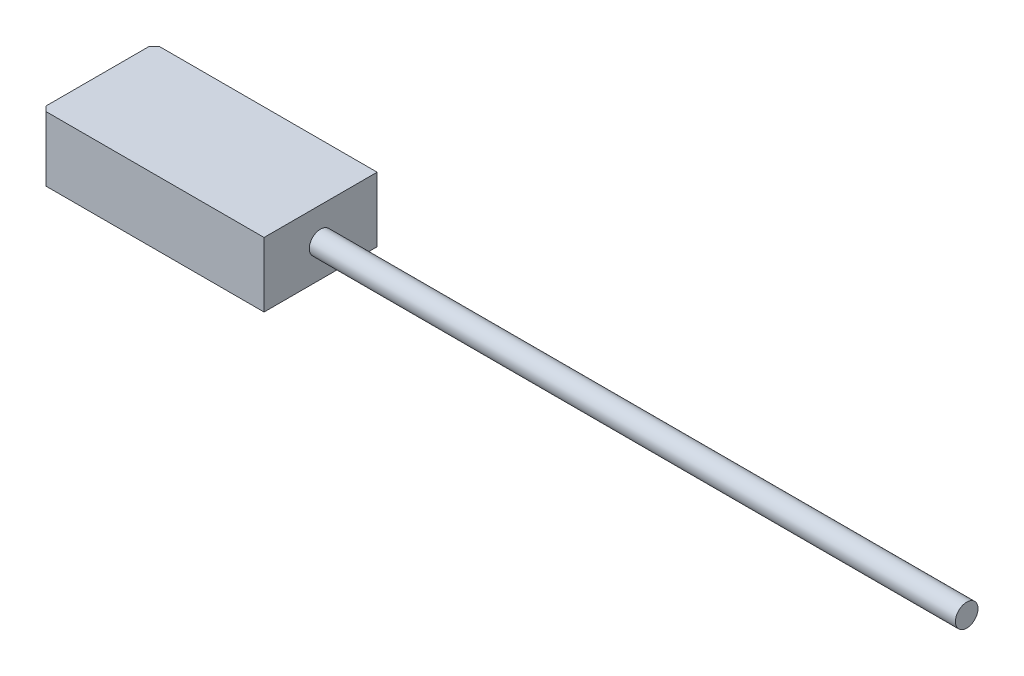
from build123d import *

# Parameters (mm, degrees)
SKETCH1_W           = 0.7
SKETCH1_H           = 0.4
BOSS_EXTRUDE1_DEPTH = 1.5
SKETCH2_R           = 0.07
BOSS_EXTRUDE2_DEPTH = 4
CHAMFER1_SIZE       = 0.12
CHAMFER2_SIZE       = 0.15


with BuildPart() as part:
    # Sketch1 → Boss-Extrude1 (new body)
    with BuildSketch(Plane(origin=(0, 0, 0), x_dir=(0, 0, -1), z_dir=(1, 0, 0))):
        Rectangle(SKETCH1_W, SKETCH1_H)
    extrude(amount=BOSS_EXTRUDE1_DEPTH)

    # Sketch2 → Boss-Extrude2 (add)
    with BuildSketch(Plane(origin=(1.5, 0, 0), x_dir=(0, 0, -1), z_dir=(1, 0, 0))):
        Circle(SKETCH2_R)
    extrude(amount=BOSS_EXTRUDE2_DEPTH)

    # Chamfer1
    chamfer1_edges = [part.edges().sort_by_distance(p)[0] for p in [
        (0, -0.2, 0),
        (0, 0.2, 0),
    ]]
    chamfer(chamfer1_edges, length=CHAMFER1_SIZE)

    # Chamfer2
    chamfer2_edges = [part.edges().sort_by_distance(p)[0] for p in [
        (0, 0, 0.35),
        (0, 0, -0.35),
    ]]
    chamfer(chamfer2_edges, length=CHAMFER2_SIZE)


solid = part.part
